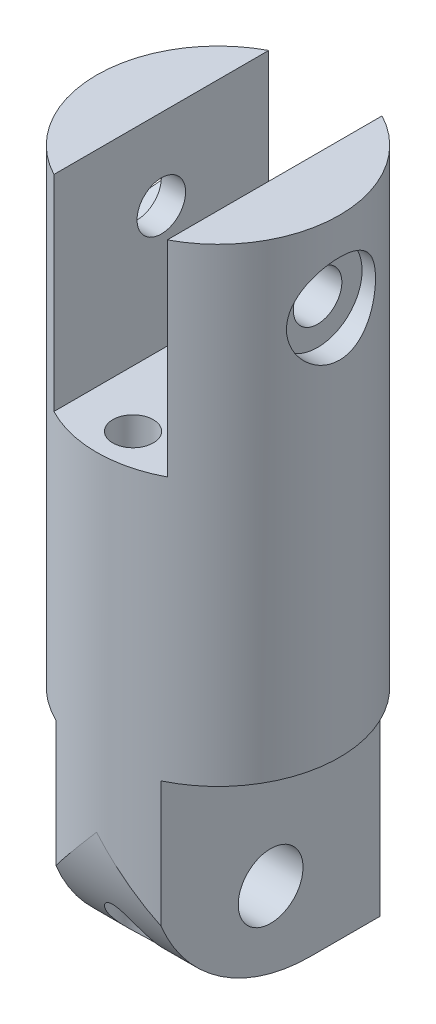
from build123d import *

# Parameters (mm, degrees)
SKETCH1_W           = 6.5
SKETCH1_H           = 14
BOSS_EXTRUDE1_DEPTH = 15
FILLET1_R           = 10
SKETCH2_R           = 2
CUT_EXTRUDE1_DEPTH  = 18.783419244
SKETCH4_R           = 7.5
BOSS_EXTRUDE2_DEPTH = 29
SKETCH6_W           = 7
SKETCH6_H           = 12.68
CUT_EXTRUDE2_DEPTH  = 40.714606885
CUT_EXTRUDE3_DEPTH  = 34.5
SKETCH8_R           = 1.5
CUT_EXTRUDE4_DEPTH  = 21
SKETCH9_R           = 2.75
CUT_EXTRUDE5_DEPTH  = 10
CUT_EXTRUDE6_DEPTH  = 10
SKETCH11_R          = 1.25
CUT_EXTRUDE7_DEPTH  = 40


with BuildPart() as part:
    # Sketch1 → Boss-Extrude1 (new body)
    with BuildSketch(Plane.XY):
        Rectangle(SKETCH1_W, SKETCH1_H)
    extrude(amount=BOSS_EXTRUDE1_DEPTH)

    # Fillet1
    fillet1_edges = [part.edges().sort_by_distance(p)[0] for p in [
        (0, -7, 15),
    ]]
    fillet(fillet1_edges, radius=FILLET1_R)

    # Sketch2 → Cut-Extrude1 (cut, through all)
    with BuildSketch(Plane(origin=(3.25, 0, 0), x_dir=(0, 0, -1), z_dir=(1, 0, 0))):
        with Locations((-7.5, -2)):
            Circle(SKETCH2_R)
    extrude(amount=-CUT_EXTRUDE1_DEPTH, mode=Mode.SUBTRACT)

    # Sketch4 → Boss-Extrude2 (add)
    with BuildSketch(Plane(origin=(0, 7, 0), x_dir=(1, 0, 0), z_dir=(0, 1, 0))):
        with Locations((0, -7.5)):
            Circle(SKETCH4_R)
    extrude(amount=BOSS_EXTRUDE2_DEPTH)

    # Sketch6 → Cut-Extrude2 (cut, through all)
    with BuildSketch(Plane(origin=(0, 0, 0), x_dir=(-1, 0, 0), z_dir=(0, 0, -1))):
        with Locations((0, 29.66)):
            Rectangle(SKETCH6_W, SKETCH6_H)
    extrude(amount=-CUT_EXTRUDE2_DEPTH, mode=Mode.SUBTRACT)

    # Sketch7 → Cut-Extrude3 (cut, through all)
    with BuildSketch(Plane(origin=(0, 7, 0), x_dir=(1, 0, 0), z_dir=(0, 1, 0))):
        with BuildLine():
            ThreePointArc((0, -15), (-1.666673801, -14.812468697), (-3.25, -14.259252917))
            Line((-3.25, -14.259252917), (-3.25, -15))
            Line((-3.25, -15), (0, -15))
        make_face()
        with BuildLine():
            ThreePointArc((3.25, -14.259252917), (1.666673801, -14.812468697), (0, -15))
            Line((0, -15), (3.25, -15))
            Line((3.25, -15), (3.25, -14.259252917))
        make_face()
        with BuildLine():
            ThreePointArc((-3.25, -0.740747083), (-1.666673801, -0.187531303), (0, 0))
            Line((0, 0), (-3.25, 0))
            Line((-3.25, 0), (-3.25, -0.740747083))
        make_face()
        with BuildLine():
            Line((3.25, 0), (0, 0))
            ThreePointArc((0, 0), (1.666673801, -0.187531303), (3.25, -0.740747083))
            Line((3.25, -0.740747083), (3.25, 0))
        make_face()
    extrude(amount=-CUT_EXTRUDE3_DEPTH, mode=Mode.SUBTRACT)

    # Sketch8 → Cut-Extrude4 (cut, symmetric)
    with BuildSketch(Plane(origin=(-3.5, 0, 0), x_dir=(0, 0, -1), z_dir=(1, 0, 0))):
        with Locations((-7.5, 31)):
            Circle(SKETCH8_R)
    extrude(amount=CUT_EXTRUDE4_DEPTH, both=True, mode=Mode.SUBTRACT)

    # Sketch9 → Cut-Extrude5 (cut)
    with BuildSketch(Plane.ZY.offset(-6.15)):
        with Locations((7.5, 31)):
            Circle(SKETCH9_R)
    extrude(amount=-CUT_EXTRUDE5_DEPTH, mode=Mode.SUBTRACT)

    # Sketch10 → Cut-Extrude6 (cut)
    with BuildSketch(Plane(origin=(-5, 0, 0), x_dir=(0, 0, -1), z_dir=(1, 0, 0))):
        Polygon((-7.5, 34.75277675), (-10.75, 32.876388375), (-10.75, 29.123611625), (-7.5, 27.24722325), (-4.25, 29.123611625), (-4.25, 32.876388375), align=None)
    extrude(amount=-CUT_EXTRUDE6_DEPTH, mode=Mode.SUBTRACT)

    # Sketch11 → Cut-Extrude7 (cut)
    with BuildSketch(Plane.XZ.offset(7)):
        with Locations((0, 3)):
            Circle(SKETCH11_R)
        with Locations((0, 12.74882624)):
            Circle(SKETCH11_R)
    extrude(amount=-CUT_EXTRUDE7_DEPTH, mode=Mode.SUBTRACT)


solid = part.part
